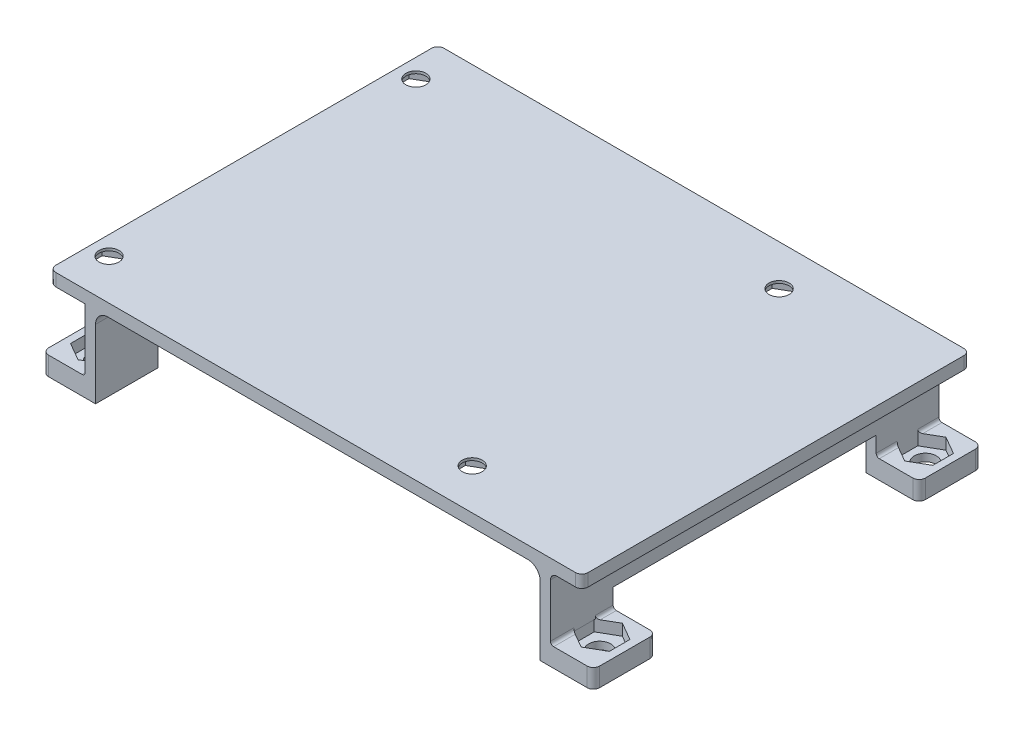
from build123d import *

# Parameters (mm, degrees)
EXTRUDE_1_DEPTH          = 31
CUT_EXTRUDE_1_DEPTH      = 56.874860179
CUT_EXTRUDE_1_DEPTH_BACK = 56.874860179
SKETCH_2_W               = 42
SKETCH_2_H               = 12
CUT_EXTRUDE_3_REACH      = 57.875
SKETCH_3_R               = 1.75
SKETCH_5_R               = 1.6
CUT_EXTRUDE_5_DEPTH      = 5
CUT_EXTRUDE_8_DEPTH      = 1.6
FILLET_1_R               = 1
FILLET_7_R               = 2
CUT_EXTRUDE_9_DEPTH      = 1.8
FILLET_5_R               = 0.5
FILLET_8_R               = 1


with BuildPart() as part:
    # 草圖1 → 填料-伸長1 (new, symmetric)
    with BuildSketch(Plane.XY):
        Polygon((-44, 0), (-44, 3), (-37.15, 3), (-37.15, 13), (-42.85, 13), (-42.85, 15), (42.15, 15), (42.15, 13), (37.15, 13), (37.15, 3), (44, 3), (44, 0), (35.5, 0), (35.5, 13), (-35.5, 13), (-35.5, 0), align=None)
    extrude(amount=EXTRUDE_1_DEPTH, both=True)

    # 草圖2 → 除料-伸長1 (cut, two sides: drawn at the far end of the back side and taken through both)
    with BuildSketch(Plane(origin=(0, 0, 0), x_dir=(0, 0, -1), z_dir=(1, 0, 0)).offset(-CUT_EXTRUDE_1_DEPTH_BACK)):
        Rectangle(SKETCH_2_W, SKETCH_2_H)
    extrude(amount=CUT_EXTRUDE_1_DEPTH + CUT_EXTRUDE_1_DEPTH_BACK, mode=Mode.SUBTRACT)

    # 草圖3 → 除料-伸長3 (cut, up to next)
    with BuildSketch(Plane(origin=(0, 0, 0), x_dir=(1, 0, 0), z_dir=(0, 1, 0)), mode=Mode.PRIVATE) as cut_extrude_3_sk1:
        with Locations(Location((-40, 26, 0), (0, 0, 90))):
            Circle(SKETCH_3_R)
    cut_extrude_3_tool1 = extrude(cut_extrude_3_sk1.sketch, amount=CUT_EXTRUDE_3_REACH, mode=Mode.PRIVATE) & part.part
    # 草圖3 → 除料-伸長3 (cut, up to next)
    with BuildSketch(Plane(origin=(0, 0, 0), x_dir=(1, 0, 0), z_dir=(0, 1, 0)), mode=Mode.PRIVATE) as cut_extrude_3_sk2:
        with Locations(Location((40, 26, 0), (0, 0, 90))):
            Circle(SKETCH_3_R)
    cut_extrude_3_tool2 = extrude(cut_extrude_3_sk2.sketch, amount=CUT_EXTRUDE_3_REACH, mode=Mode.PRIVATE) & part.part
    # 草圖3 → 除料-伸長3 (cut, up to next)
    with BuildSketch(Plane(origin=(0, 0, 0), x_dir=(1, 0, 0), z_dir=(0, 1, 0)), mode=Mode.PRIVATE) as cut_extrude_3_sk3:
        with Locations(Location((40, -26, 0), (0, 0, 90))):
            Circle(SKETCH_3_R)
    cut_extrude_3_tool3 = extrude(cut_extrude_3_sk3.sketch, amount=CUT_EXTRUDE_3_REACH, mode=Mode.PRIVATE) & part.part
    # 草圖3 → 除料-伸長3 (cut, up to next)
    with BuildSketch(Plane(origin=(0, 0, 0), x_dir=(1, 0, 0), z_dir=(0, 1, 0)), mode=Mode.PRIVATE) as cut_extrude_3_sk4:
        with Locations(Location((-40, -26, 0), (0, 0, 90))):
            Circle(SKETCH_3_R)
    cut_extrude_3_tool4 = extrude(cut_extrude_3_sk4.sketch, amount=CUT_EXTRUDE_3_REACH, mode=Mode.PRIVATE) & part.part
    add(cut_extrude_3_tool1.solids().sort_by_distance((-40, 0, -26))[0], mode=Mode.SUBTRACT)
    add(cut_extrude_3_tool2.solids().sort_by_distance((40, 0, -26))[0], mode=Mode.SUBTRACT)
    add(cut_extrude_3_tool3.solids().sort_by_distance((40, 0, 26))[0], mode=Mode.SUBTRACT)
    add(cut_extrude_3_tool4.solids().sort_by_distance((-40, 0, 26))[0], mode=Mode.SUBTRACT)

    # 草圖5 → 除料-伸長5 (cut)
    with BuildSketch(Plane(origin=(0, 15, 0), x_dir=(1, 0, 0), z_dir=(0, 1, 0))):
        with Locations(Location((-39.85, 24.5, 0), (0, 0, 270))):
            Circle(SKETCH_5_R)
        with Locations(Location((-39.85, -24.5, 0), (0, 0, 270))):
            Circle(SKETCH_5_R)
        with Locations(Location((18.15, 24.5, 0), (0, 0, 270))):
            Circle(SKETCH_5_R)
        with Locations(Location((18.15, -24.5, 0), (0, 0, 270))):
            Circle(SKETCH_5_R)
    extrude(amount=-CUT_EXTRUDE_5_DEPTH, mode=Mode.SUBTRACT)

    # 草圖17 → 除料-伸長8 (cut)
    with BuildSketch(Plane.XZ.offset(-13)):
        Polygon((20.75, 22.9988893), (20.75, 26.0011107), (18.15, 27.5022214), (15.55, 26.0011107), (15.55, 22.9988893), (18.15, 21.4977786), align=None)
        Polygon((20.75, -26.0011107), (20.75, -22.9988893), (18.15, -21.4977786), (15.55, -22.9988893), (15.55, -26.0011107), (18.15, -27.5022214), align=None)
        Polygon((-39.85, 21.4977786), (-37.25, 22.9988893), (-37.25, 26.0011107), (-39.85, 27.5022214), (-42.45, 26.0011107), (-42.45, 22.9988893), align=None)
        Polygon((-39.85, -27.5022214), (-37.25, -26.0011107), (-37.25, -22.9988893), (-39.85, -21.4977786), (-42.45, -22.9988893), (-42.45, -26.0011107), align=None)
    extrude(amount=-CUT_EXTRUDE_8_DEPTH, mode=Mode.SUBTRACT)

    # 圓角1
    fillet_1_edges = [part.edges().sort_by_distance(p)[0] for p in [
        (-44, 1.5, -31),
        (-42.85, 14, -31),
        (42.15, 14, -31),
        (44, 1.5, -31),
        (44, 1.5, 31),
        (42.15, 14, 31),
        (-44, 1.5, 21),
        (-44, 1.5, -21),
        (-42.85, 14, 31),
        (44, 1.5, -21),
        (44, 1.5, 21),
        (-44, 1.5, 31),
    ]]
    fillet(fillet_1_edges, radius=FILLET_1_R)

    # 圓角7
    fillet_7_edges = [part.edges().sort_by_distance(p)[0] for p in [
        (35.5, 13, 0),
        (-35.5, 13, 0),
    ]]
    fillet(fillet_7_edges, radius=FILLET_7_R)

    # 草圖19 → 除料-伸長9 (cut)
    with BuildSketch(Plane(origin=(0, 3, 0), x_dir=(1, 0, 0), z_dir=(0, 1, 0))):
        Polygon((-40, -29.290896534), (-37.15, -27.645448267), (-37.15, -24.354551733), (-40, -22.709103466), (-42.85, -24.354551733), (-42.85, -27.645448267), align=None)
        Polygon((39.896071136, -28.850899892), (42.746071136, -27.205451625), (42.746071136, -23.91455509), (39.896071136, -22.269106823), (37.046071136, -23.91455509), (37.046071136, -27.205451625), align=None)
        Polygon((42.85, 24.354551733), (42.85, 27.645448267), (40, 29.290896534), (37.15, 27.645448267), (37.15, 24.354551733), (40, 22.709103466), align=None)
        Polygon((-40, 22.709103466), (-37.15, 24.354551733), (-37.15, 27.645448267), (-40, 29.290896534), (-42.85, 27.645448267), (-42.85, 24.354551733), align=None)
    extrude(amount=-CUT_EXTRUDE_9_DEPTH, mode=Mode.SUBTRACT)

    # 圓角5
    fillet_5_edges = [part.edges().sort_by_distance(p)[0] for p in [
        (-37.15, 3, 29.322724134),
        (37.15, 3, 29.132727491),
        (-37.15, 3, 22.677275866),
        (-37.15, 3, -29.322724134),
        (37.15, 3, -29.322724134),
        (37.15, 3, 22.427275866),
        (-37.15, 3, -22.677275866),
        (37.15, 3, -22.677275866),
    ]]
    fillet(fillet_5_edges, radius=FILLET_5_R)

    # 圓角8
    fillet_8_edges = [part.edges().sort_by_distance(p)[0] for p in [
        (37.15, 13, 0),
    ]]
    fillet(fillet_8_edges, radius=FILLET_8_R)


solid = part.part
